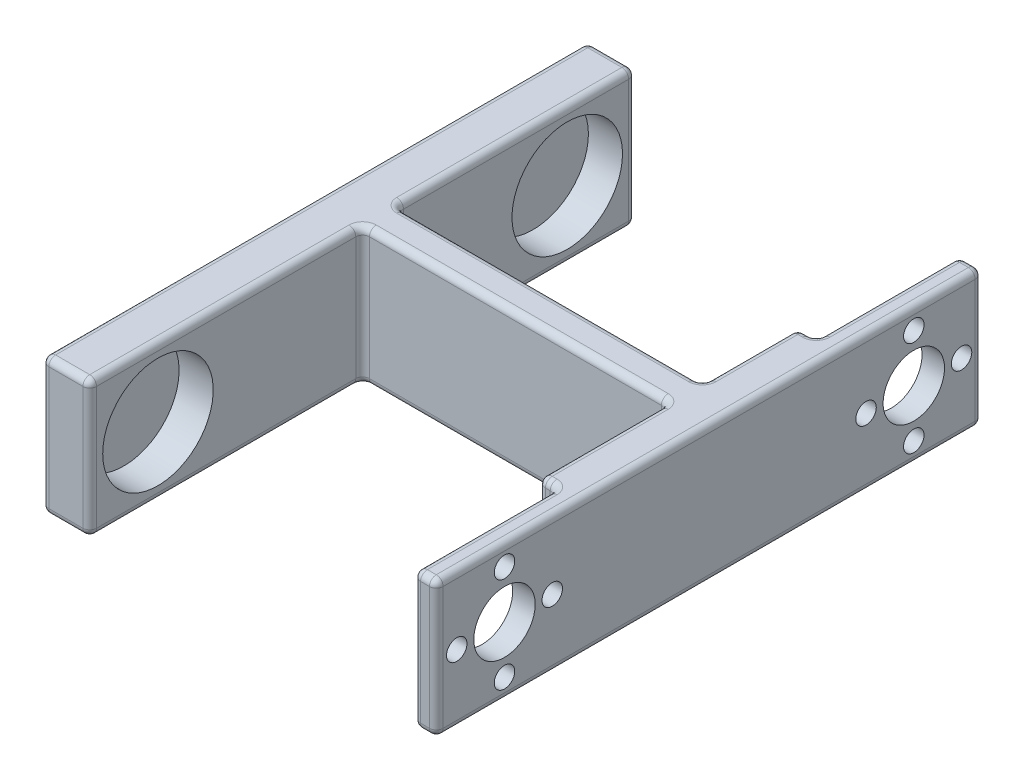
from build123d import *

# Parameters (mm, degrees)
BOSS_EXTRUDE1_DEPTH = 20
SKETCH4_R           = 1.5
SKETCH4_R_2         = 4.5
CUT_EXTRUDE1_DEPTH  = 10
CUT_EXTRUDE2_START  = -3.3
SKETCH5_W           = 21
SKETCH5_H           = 20
CUT_EXTRUDE2_DEPTH  = 2.7
FILLET1_R           = 1
SKETCH3_R           = 8.1
CUT_EXTRUDE3_DEPTH  = 5


with BuildPart() as part:
    # Sketch2 → Boss-Extrude1 (new body)
    with BuildSketch(Plane(origin=(0, 0, 0), x_dir=(1, 0, 0), z_dir=(0, 1, 0))):
        Polygon((0, 0), (0, -80), (6, -80), (6, -40), (50.8, -40), (50.8, -80), (57.8, -80), (57.8, 0), (50.8, 0), (50.8, -35), (6, -35), (6, 0), align=None)
    extrude(amount=BOSS_EXTRUDE1_DEPTH)

    # Sketch4 → Cut-Extrude1 (cut)
    with BuildSketch(Plane.ZY):
        with Locations((70, 17)):
            Circle(SKETCH4_R)
        with Locations((77, 10)):
            Circle(SKETCH4_R)
        with Locations((70, 3)):
            Circle(SKETCH4_R)
        with Locations((63, 10)):
            Circle(SKETCH4_R)
        with Locations((70, 10)):
            Circle(SKETCH4_R_2)
    cut_extrude1 = extrude(amount=-CUT_EXTRUDE1_DEPTH, mode=Mode.SUBTRACT)

    # Sketch5 → Cut-Extrude2 (cut)
    with BuildSketch(Plane.ZY.offset(CUT_EXTRUDE2_START)):
        with Locations((69.5, 10)):
            Rectangle(SKETCH5_W, SKETCH5_H)
    cut_extrude2 = extrude(amount=-CUT_EXTRUDE2_DEPTH, mode=Mode.SUBTRACT)

    # Mirror1: Cut-Extrude1, Cut-Extrude2 across plane
    add(cut_extrude1.mirror(Plane.XY.offset(40)), mode=Mode.SUBTRACT)
    add(cut_extrude2.mirror(Plane.XY.offset(40)), mode=Mode.SUBTRACT)

    # Fillet1
    fillet1_edges = [part.edges().sort_by_distance(p)[0] for p in [
        (1.65, 0, 0),
        (1.65, 20, 0),
        (3.3, 10, 21),
        (4.65, 20, 21),
        (3.3, 0, 10.5),
        (4.65, 0, 21),
        (3.3, 10, 0),
        (3.3, 20, 10.5),
        (6, 0, 28),
        (6, 10, 21),
        (28.4, 0, 35),
        (1.65, 20, 80),
        (50.8, 0, 17.5),
        (54.3, 0, 0),
        (57.8, 0, 40),
        (54.3, 0, 80),
        (50.8, 0, 60),
        (28.4, 0, 40),
        (1.65, 0, 80),
        (0, 0, 40),
        (6, 10, 35),
        (50.8, 10, 35),
        (28.4, 20, 40),
        (50.8, 10, 0),
        (57.8, 10, 0),
        (57.8, 10, 80),
        (50.8, 10, 80),
        (50.8, 10, 40),
        (6, 10, 40),
        (0, 10, 80),
        (0, 10, 0),
        (50.8, 20, 60),
        (54.3, 20, 80),
        (57.8, 20, 40),
        (54.3, 20, 0),
        (50.8, 20, 17.5),
        (28.4, 20, 35),
        (6, 20, 28),
        (6, 0, 49.5),
        (6, 20, 49.5),
        (3.3, 10, 59),
        (3.3, 0, 69.5),
        (3.3, 10, 80),
        (3.3, 20, 69.5),
        (6, 10, 59),
        (4.65, 0, 59),
        (4.65, 20, 59),
        (0, 20, 40),
    ]]
    fillet(fillet1_edges, radius=FILLET1_R)

    # Sketch3 → Cut-Extrude3 (cut)
    with BuildSketch(Plane.ZY.offset(-50.8)):
        with Locations((70, 10)):
            Circle(SKETCH3_R)
        with Locations(Location((10, 10, 0), (0, 0, 180))):
            Circle(SKETCH3_R)
    extrude(amount=-CUT_EXTRUDE3_DEPTH, mode=Mode.SUBTRACT)


with BuildPart() as body_2:
    # Mirror2: mirrored copy
    add(part.part.mirror(Plane.ZY.offset(-28.9)))


solid = body_2.part
